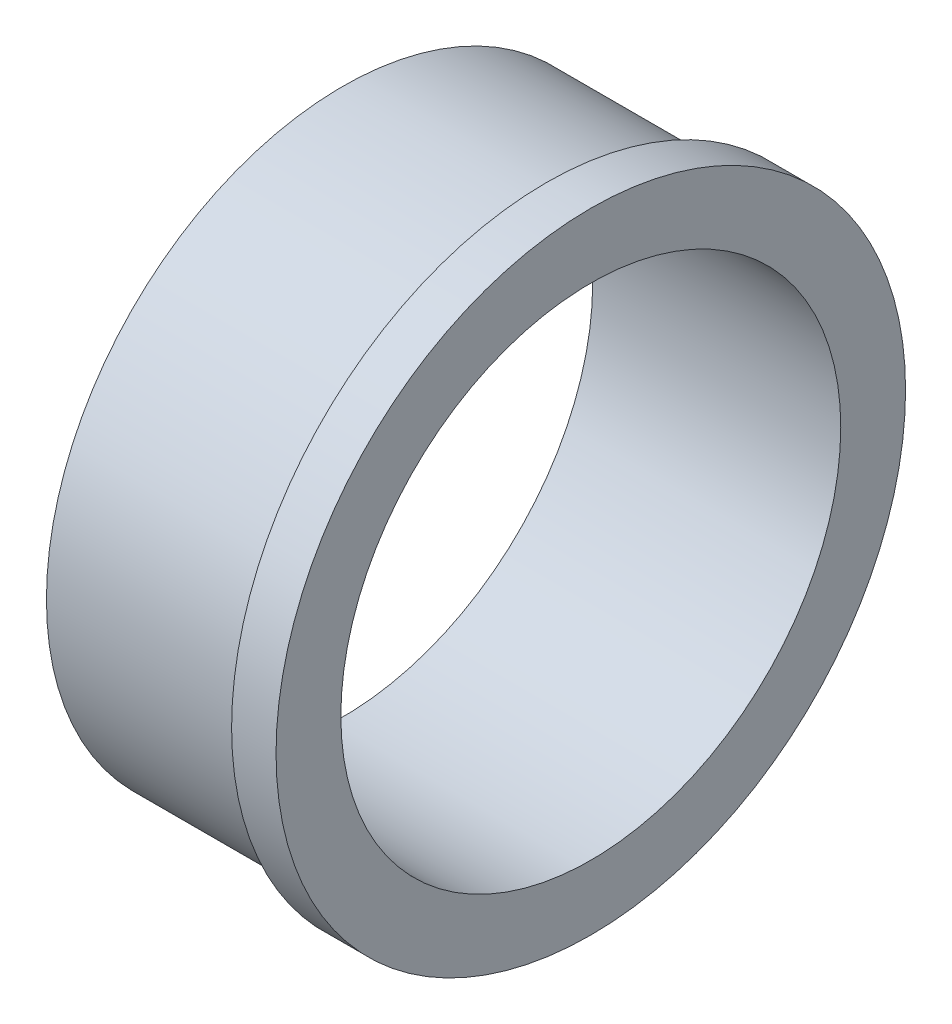
from build123d import *


with BuildPart() as part:
    # Esquisse1 → Révolution1 (revolve)
    with BuildSketch(Plane.XY, mode=Mode.PRIVATE) as r_volution1_sk:
        Polygon((0, 10.125), (10.05, 10.125), (10.05, 12.75), (8.25, 12.75), (8.25, 12), (0, 12), align=None)
    revolve(r_volution1_sk.sketch.rotate(Axis((0, 0, 0), (1, 0, 0)), 90), axis=Axis((0, 0, 0), (1, 0, 0)))


solid = part.part
